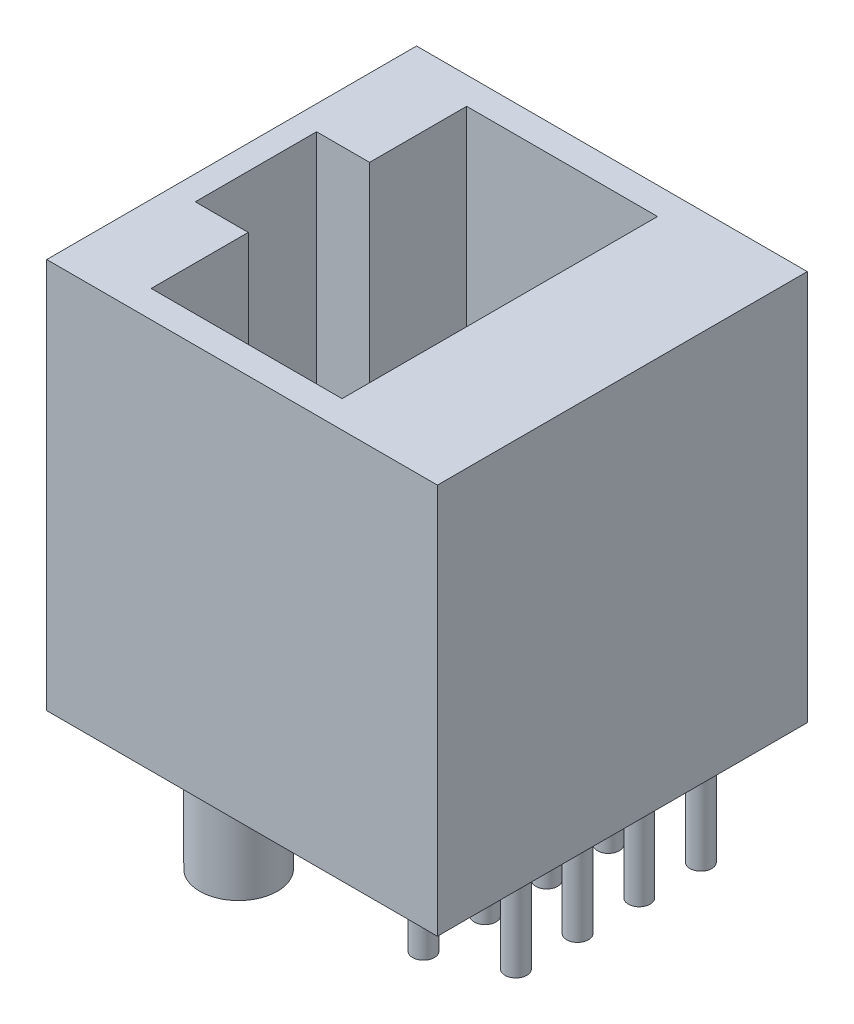
from build123d import *

# Parameters (mm, degrees)
SKETCH1_W            = 16.1
SKETCH1_H            = 16.1
BOSS_EXTRUDE1_DEPTH  = 15.24
SKETCH2_R            = 1.6
BOSS_EXTRUDE2_DEPTH  = 3.6
SKETCH2_4_R          = 0.45
BOSS_EXTRUDE3_DEPTH  = 4
SKETCH2_5_R          = 0.45
BOSS_EXTRUDE4_DEPTH  = 4
LPATTERN1_COUNT      = 3
LPATTERN1_PITCH      = 2.54
LPATTERN1_COUNT_DIR2 = 2
LPATTERN1_PITCH_DIR2 = 2.54
LPATTERN2_COUNT      = 2
LPATTERN2_PITCH      = 2.54
LPATTERN2_COUNT_DIR2 = 3
LPATTERN2_PITCH_DIR2 = 2.54
CUT_EXTRUDE1_DEPTH   = 10


with BuildPart() as part:
    # Sketch1 → Boss-Extrude1 (new body)
    with BuildSketch(Plane.XY):
        Rectangle(SKETCH1_W, SKETCH1_H)
    extrude(amount=BOSS_EXTRUDE1_DEPTH)

    # Sketch2 → Boss-Extrude2 (add)
    with BuildSketch(Plane.XZ.offset(8.05)):
        with Locations((-2.05, 13.335)):
            Circle(SKETCH2_R)
        with Locations((-2.05, 1.905)):
            Circle(SKETCH2_R)
    extrude(amount=BOSS_EXTRUDE2_DEPTH)

    # Sketch2<4> → Boss-Extrude3 (add)
    with BuildSketch(Plane.XZ.offset(8.05)):
        with Locations((4.3, 6.985)):
            Circle(SKETCH2_4_R)
    boss_extrude3 = extrude(amount=BOSS_EXTRUDE3_DEPTH)

    # Sketch2<5> → Boss-Extrude4 (add)
    with BuildSketch(Plane.XZ.offset(8.05)):
        with Locations((6.84, 8.255)):
            Circle(SKETCH2_5_R)
    boss_extrude4 = extrude(amount=BOSS_EXTRUDE4_DEPTH)

    # LPattern1: Boss-Extrude4 3 × 2
    with Locations(*[Vector(0, 0, -1) * (i * LPATTERN1_PITCH) + Vector(0, 0, 1) * (j * LPATTERN1_PITCH_DIR2) for i in range(LPATTERN1_COUNT) for j in range(LPATTERN1_COUNT_DIR2) if (i, j) != (0, 0)]):
        add(boss_extrude4)

    # LPattern2: Boss-Extrude3 2 × 3
    with Locations(*[Vector(0, 0, -1) * (i * LPATTERN2_PITCH) + Vector(0, 0, 1) * (j * LPATTERN2_PITCH_DIR2) for i in range(LPATTERN2_COUNT) for j in range(LPATTERN2_COUNT_DIR2) if (i, j) != (0, 0)]):
        add(boss_extrude3)

    # Sketch3 → Cut-Extrude1 (cut)
    with BuildSketch(Plane(origin=(0, 8.05, 0), x_dir=(1, 0, 0), z_dir=(0, 1, 0))):
        Polygon((3, -14.12), (-4.865675626, -14.12), (-4.865675626, -10.12), (-7.05, -10.12), (-7.05, -5.12), (-4.865675626, -5.12), (-4.865675626, -1.12), (3, -1.12), align=None)
    extrude(amount=-CUT_EXTRUDE1_DEPTH, mode=Mode.SUBTRACT)


solid = part.part
